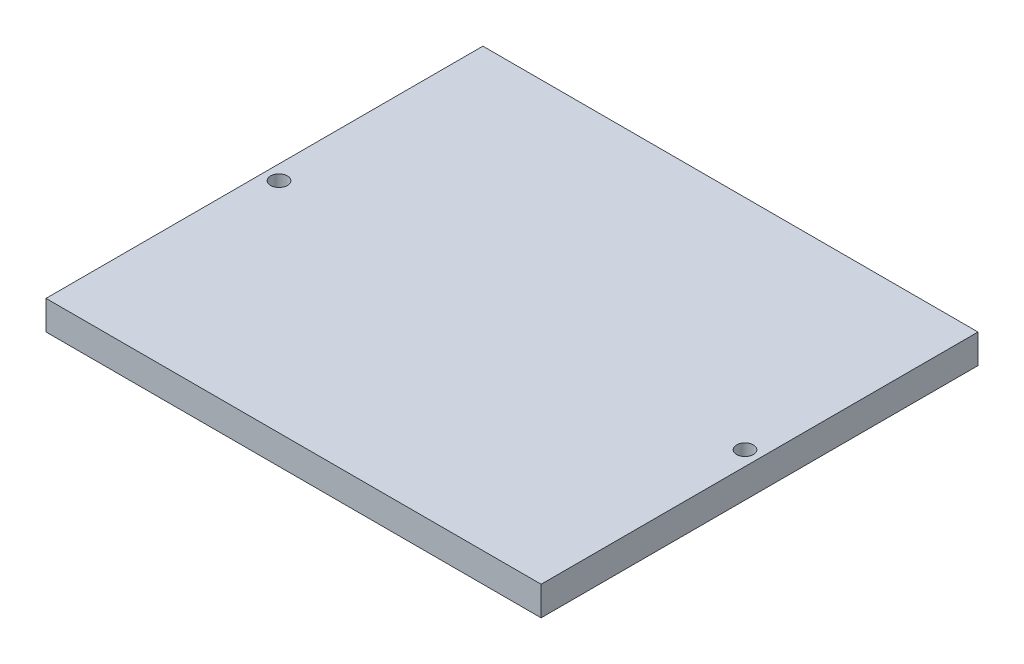
from build123d import *

# Parameters (mm, degrees)
SKETCH1_W                 = 107.95
SKETCH1_H                 = 95.25
BOSS_EXTRUDE1_DEPTH       = 6.35
F_6_CLEARANCE_HOLE1_D     = 3.6576
F_6_CLEARANCE_HOLE1_DEPTH = 25.4
F_6_CLEARANCE_HOLE1_TIP   = 1.0988539


with BuildPart() as part:
    # Sketch1 → Boss-Extrude1 (new body)
    with BuildSketch(Plane(origin=(0, 0, 0), x_dir=(1, 0, 0), z_dir=(0, 1, 0))):
        Rectangle(SKETCH1_W, SKETCH1_H)
    extrude(amount=BOSS_EXTRUDE1_DEPTH)

    # #6 Clearance Hole1
    with Locations(Plane(origin=(0, 6.35, 0), x_dir=(-1, 0, 0), z_dir=(0, 1, 0))):
        with Locations((50.8, 0), (-50.8, 0)):
            Hole(F_6_CLEARANCE_HOLE1_D / 2, depth=F_6_CLEARANCE_HOLE1_DEPTH)
            with Locations((0, 0, -(F_6_CLEARANCE_HOLE1_DEPTH + F_6_CLEARANCE_HOLE1_TIP / 2))):  # 118° drill point
                Cone(0, F_6_CLEARANCE_HOLE1_D / 2, F_6_CLEARANCE_HOLE1_TIP, mode=Mode.SUBTRACT)


solid = part.part
